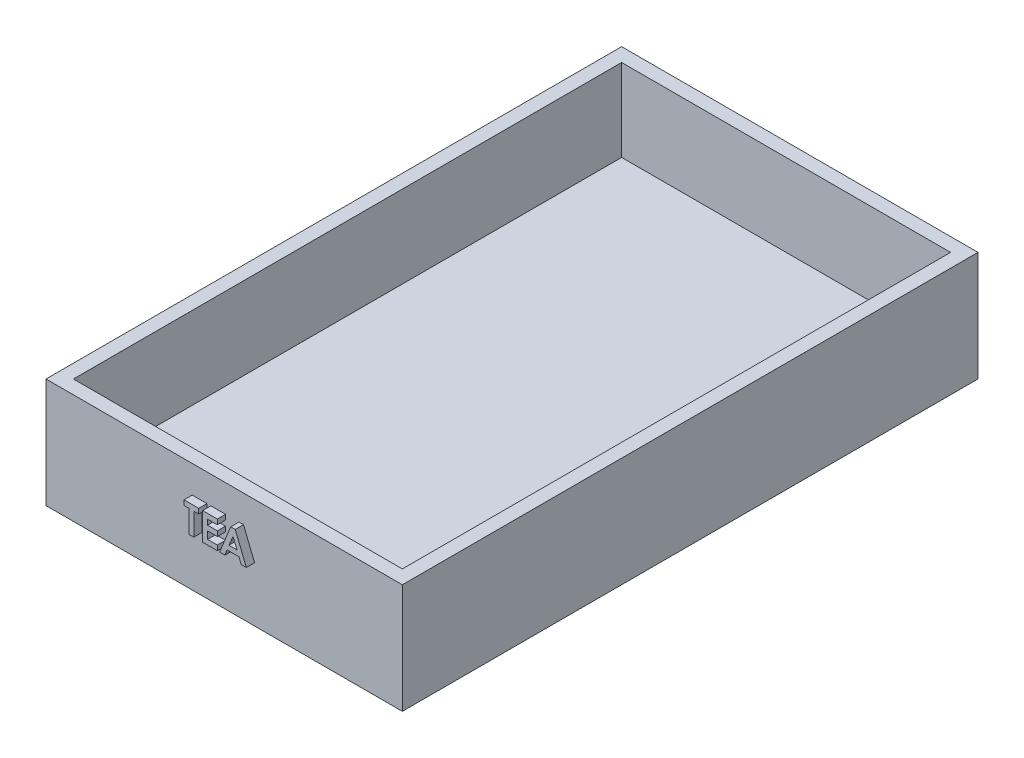
from build123d import *

# Parameters (mm, degrees)
SKETCH1_W           = 130
SKETCH1_H           = 210
BOSS_EXTRUDE1_DEPTH = 10
SKETCH2_W           = 130
SKETCH2_H           = 210
SKETCH2_W_2         = 120
SKETCH2_H_2         = 200
BOSS_EXTRUDE2_DEPTH = 30
BOSS_EXTRUDE3_DEPTH = 3


with BuildPart() as part:
    # Sketch1 → Boss-Extrude1 (new body)
    with BuildSketch(Plane(origin=(0, 0, 0), x_dir=(1, 0, 0), z_dir=(0, 1, 0))):
        with Locations((65, 105)):
            Rectangle(SKETCH1_W, SKETCH1_H)
    extrude(amount=BOSS_EXTRUDE1_DEPTH)

    # Sketch2 → Boss-Extrude2 (add)
    with BuildSketch(Plane(origin=(0, 10, 0), x_dir=(1, 0, 0), z_dir=(0, 1, 0))):
        with Locations((65, 105)):
            Rectangle(SKETCH2_W, SKETCH2_H)
        with Locations((65, 105)):
            Rectangle(SKETCH2_W_2, SKETCH2_H_2, mode=Mode.SUBTRACT)
    extrude(amount=BOSS_EXTRUDE2_DEPTH)

    # Sketch3 → Boss-Extrude3 (add)
    # profile 1 of 3: a face of its own
    with BuildSketch(Plane.XY):
        Polygon((53.333333333, 30), (58.717948718, 30), (58.717948718, 28.205128205), (56.923076923, 28.205128205), (56.923076923, 20), (55.128205128, 20), (55.128205128, 28.205128205), (53.333333333, 28.205128205), align=None)
    # profile 2 of 3: a face of its own
    with BuildSketch(Plane.XY):
        Polygon((60.128205128, 30), (65.512820513, 30), (65.512820513, 28.205128205), (61.923076923, 28.205128205), (61.923076923, 26.282051282), (65.512820513, 26.282051282), (65.512820513, 24.487179487), (61.923076923, 24.487179487), (61.923076923, 21.794871795), (65.512820513, 21.794871795), (65.512820513, 20), (60.128205128, 20), align=None)
    # profile 3 of 3: a face of its own
    with BuildSketch(Plane.XY):
        Polygon((70.38661859, 30), (72.051282051, 30), (76.08974359, 20), (74.172676282, 20), (73.395432692, 22.051282051), (69.038461538, 22.051282051), (68.261217949, 20), (66.346153846, 20), align=None)
        Polygon((71.217948718, 27.317708333), (69.719551282, 23.846153846), (72.716346154, 23.846153846), align=None, mode=Mode.SUBTRACT)
    extrude(amount=BOSS_EXTRUDE3_DEPTH)


solid = part.part
